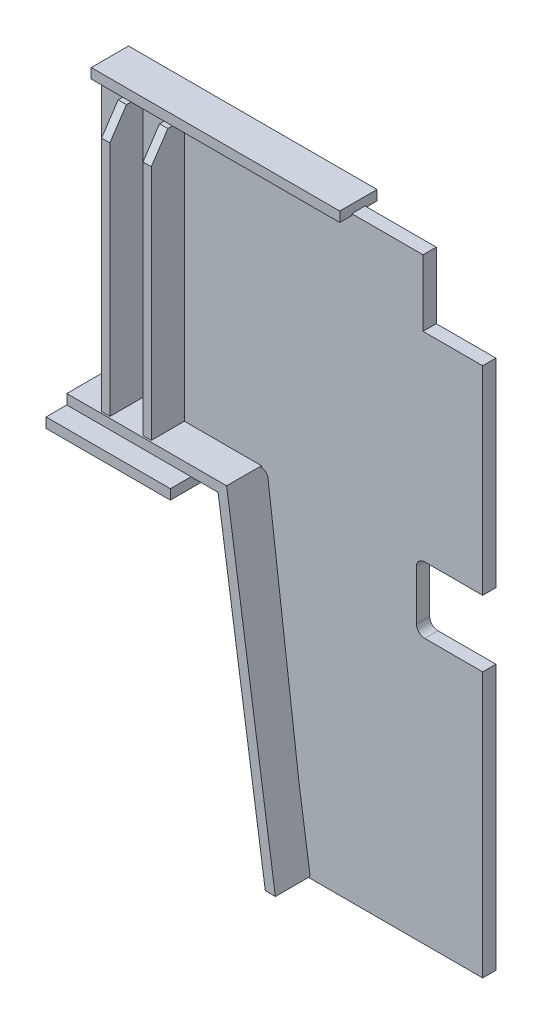
from build123d import *

# Parameters (mm, degrees)
EXTRUDE_1242_DEPTH   = 16
EXTRUDE_2_DEPTH      = 40
EXTRUDE_2_DEPTH_BACK = 56
SKETCH_3_W           = 10
SKETCH_3_H           = 316
CUT_EXTRUDE_1_DEPTH  = 836.425640018
CUT_EXTRUDE_2_DEPTH  = 836.425640018
EXTRUDE_5_DEPTH      = 42
EXTRUDE_5_DEPTH_BACK = 58
EXTRUDE_6_DEPTH      = 14.5
EXTRUDE_6_DEPTH_BACK = 30.5
SKETCH_7_W           = 300
SKETCH_7_H           = 12
SKETCH_8_W           = 150
SKETCH_8_H           = 150
EXTRUDE_7_DEPTH      = 12


with BuildPart() as part:
    # 草图1 → Extrude 1242 (new body)
    with BuildSketch(Plane.XY):
        with BuildLine():
            Line((0, -320), (-70, -320))
            ThreePointArc((-70, -320), (-77.071067812, -322.928932188), (-80, -330))
            Line((-80, -330), (-80, -390))
            ThreePointArc((-80, -390), (-77.071067812, -397.071067812), (-70, -400))
            Line((-70, -400), (0, -400))
            Line((0, -400), (0, -720))
            Line((0, -720), (-210, -720))
            Line((-210, -720), (-259.124034735, -327.007722123))
            ThreePointArc((-259.124034735, -327.007722123), (-261.767837242, -322.002574593), (-267.062257748, -320))
            Line((-267.062257748, -320), (-460, -320))
            Line((-460, -320), (-460, 0))
            Line((-460, 0), (-72, 0))
            Line((-72, 0), (-72, -80))
            Line((-72, -80), (0, -80))
            Line((0, -80), (0, -320))
        make_face()
    extrude(amount=EXTRUDE_1242_DEPTH)

    # 草图3 → 凸台-拉伸2 (add, two sides: drawn at the far end of the back side and taken through both)
    with BuildSketch(Plane.XY.offset(16).offset(-EXTRUDE_2_DEPTH_BACK)):
        with Locations((-415, -160)):
            Rectangle(SKETCH_3_W, SKETCH_3_H)
        with Locations((-365, -160)):
            Rectangle(SKETCH_3_W, SKETCH_3_H)
    extrude(amount=EXTRUDE_2_DEPTH + EXTRUDE_2_DEPTH_BACK)

    # 草图4 → 切除-拉伸1 (cut, through all)
    with BuildSketch(Plane.ZY.offset(420)):
        Polygon((-20, -2), (-45.5, -32), (-45.5, -2), align=None)
    extrude(amount=-CUT_EXTRUDE_1_DEPTH, mode=Mode.SUBTRACT)

    # 草图5 → 切除-拉伸2 (cut, through all)
    with BuildSketch(Plane.ZY.offset(420)):
        Polygon((36, -2), (56, -32), (56, -2), align=None)
    extrude(amount=-CUT_EXTRUDE_2_DEPTH, mode=Mode.SUBTRACT)

    # 草图6 → 凸台-拉伸5 (add, two sides: drawn at the far end of the back side and taken through both)
    with BuildSketch(Plane.XY.offset(16).offset(-EXTRUDE_5_DEPTH_BACK)):
        Polygon((-267.062257748, -318), (-460, -318), (-460, -330), (-277.426505546, -330), (-220.363518026, -718), (-208.234435563, -718), align=None)
    extrude(amount=EXTRUDE_5_DEPTH + EXTRUDE_5_DEPTH_BACK)

    # 草图7 → 凸台-拉伸6 (add, two sides: drawn at the far end of the back side and taken through both)
    with BuildSketch(Plane(origin=(0, 0, 0), x_dir=(-1, 0, 0), z_dir=(0, 0, -1)).offset(-EXTRUDE_6_DEPTH_BACK)):
        with Locations((308, 4)):
            Rectangle(SKETCH_7_W, SKETCH_7_H)
    extrude(amount=EXTRUDE_6_DEPTH + EXTRUDE_6_DEPTH_BACK)

    # 草图8 → 凸台-拉伸7 (add)
    with BuildSketch(Plane.XZ.offset(330)):
        with Locations((-385, 8)):
            Rectangle(SKETCH_8_W, SKETCH_8_H)
    extrude(amount=EXTRUDE_7_DEPTH)


solid = part.part
